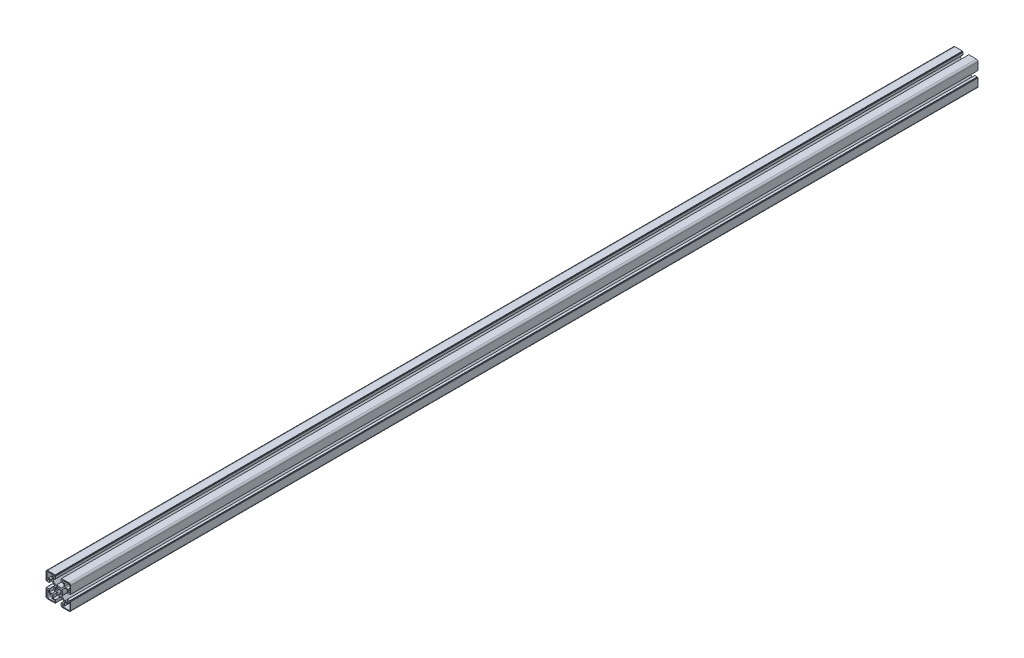
from build123d import *

# Parameters (mm, degrees)
BOSS_EXTRUDE1_DEPTH = 829.25


with BuildPart() as part:
    # Sketch1 → Boss-Extrude1 (new, symmetric)
    with BuildSketch(Plane.XY):
        with BuildLine():
            Line((-19.5072, 22.5044), (-5.7912, 22.5044))
            Line((-5.7912, 22.5044), (-5.7912, 21.0058))
            Line((-5.7912, 21.0058), (-5.0038, 21.0058))
            Line((-5.0038, 21.0058), (-5.0038, 16.51))
            Line((-5.0038, 16.51), (-10.0457, 16.51))
            Line((-10.0457, 16.51), (-10.0457, 11.680106614))
            Line((-10.0457, 11.680106614), (-4.781026704, 6.415433318))
            ThreePointArc((-4.781026704, 6.415433318), (0, 8.001), (4.781026704, 6.415433318))
            Line((4.781026704, 6.415433318), (10.0457, 11.680106614))
            Line((10.0457, 11.680106614), (10.0457, 16.51))
            Line((10.0457, 16.51), (5.0038, 16.51))
            Line((5.0038, 16.51), (5.0038, 21.0058))
            Line((5.0038, 21.0058), (5.7912, 21.0058))
            Line((5.7912, 21.0058), (5.7912, 22.5044))
            Line((5.7912, 22.5044), (19.5072, 22.5044))
            ThreePointArc((19.5072, 22.5044), (21.626540445, 21.626540445), (22.5044, 19.5072))
            Line((22.5044, 19.5072), (22.5044, 5.7912))
            Line((22.5044, 5.7912), (21.0058, 5.7912))
            Line((21.0058, 5.7912), (21.0058, 5.0038))
            Line((21.0058, 5.0038), (16.51, 5.0038))
            Line((16.51, 5.0038), (16.51, 10.0457))
            Line((16.51, 10.0457), (11.680106614, 10.0457))
            Line((11.680106614, 10.0457), (6.415433318, 4.781026704))
            ThreePointArc((6.415433318, 4.781026704), (8.001, 0), (6.415433318, -4.781026704))
            Line((6.415433318, -4.781026704), (11.680106614, -10.0457))
            Line((11.680106614, -10.0457), (16.51, -10.0457))
            Line((16.51, -10.0457), (16.51, -5.0038))
            Line((16.51, -5.0038), (21.0058, -5.0038))
            Line((21.0058, -5.0038), (21.0058, -5.7912))
            Line((21.0058, -5.7912), (22.5044, -5.7912))
            Line((22.5044, -5.7912), (22.5044, -19.5072))
            ThreePointArc((22.5044, -19.5072), (21.626540445, -21.626540445), (19.5072, -22.5044))
            Line((19.5072, -22.5044), (5.7912, -22.5044))
            Line((5.7912, -22.5044), (5.7912, -21.0058))
            Line((5.7912, -21.0058), (5.0038, -21.0058))
            Line((5.0038, -21.0058), (5.0038, -16.51))
            Line((5.0038, -16.51), (10.0457, -16.51))
            Line((10.0457, -16.51), (10.0457, -11.680106614))
            Line((10.0457, -11.680106614), (4.781026704, -6.415433318))
            ThreePointArc((4.781026704, -6.415433318), (0, -8.001), (-4.781026704, -6.415433318))
            Line((-4.781026704, -6.415433318), (-10.0457, -11.680106614))
            Line((-10.0457, -11.680106614), (-10.0457, -16.51))
            Line((-10.0457, -16.51), (-5.0038, -16.51))
            Line((-5.0038, -16.51), (-5.0038, -21.0058))
            Line((-5.0038, -21.0058), (-5.7912, -21.0058))
            Line((-5.7912, -21.0058), (-5.7912, -22.5044))
            Line((-5.7912, -22.5044), (-19.5072, -22.5044))
            ThreePointArc((-19.5072, -22.5044), (-21.626540445, -21.626540445), (-22.5044, -19.5072))
            Line((-22.5044, -19.5072), (-22.5044, -5.7912))
            Line((-22.5044, -5.7912), (-21.0058, -5.7912))
            Line((-21.0058, -5.7912), (-21.0058, -5.0038))
            Line((-21.0058, -5.0038), (-16.51, -5.0038))
            Line((-16.51, -5.0038), (-16.51, -10.0457))
            Line((-16.51, -10.0457), (-11.680106614, -10.0457))
            Line((-11.680106614, -10.0457), (-6.415433318, -4.781026704))
            ThreePointArc((-6.415433318, -4.781026704), (-8.001, 0), (-6.415433318, 4.781026704))
            Line((-6.415433318, 4.781026704), (-11.680106614, 10.0457))
            Line((-11.680106614, 10.0457), (-16.51, 10.0457))
            Line((-16.51, 10.0457), (-16.51, 5.0038))
            Line((-16.51, 5.0038), (-21.0058, 5.0038))
            Line((-21.0058, 5.0038), (-21.0058, 5.7912))
            Line((-21.0058, 5.7912), (-22.5044, 5.7912))
            Line((-22.5044, 5.7912), (-22.5044, 19.5072))
            ThreePointArc((-22.5044, 19.5072), (-21.626540445, 21.626540445), (-19.5072, 22.5044))
        make_face()
        with BuildLine():
            Line((-18.0086, 11.5443), (-13.0429, 11.5443))
            ThreePointArc((-13.0429, 11.5443), (-11.983229778, 11.983229778), (-11.5443, 13.0429))
            Line((-11.5443, 13.0429), (-11.5443, 18.0086))
            Line((-11.5443, 18.0086), (-8.7884, 18.0086))
            ThreePointArc((-8.7884, 18.0086), (-7.2898, 19.5072), (-8.7884, 21.0058))
            Line((-8.7884, 21.0058), (-19.5072, 21.0058))
            ThreePointArc((-19.5072, 21.0058), (-20.566870222, 20.566870222), (-21.0058, 19.5072))
            Line((-21.0058, 19.5072), (-21.0058, 8.7884))
            ThreePointArc((-21.0058, 8.7884), (-19.5072, 7.2898), (-18.0086, 8.7884))
            Line((-18.0086, 8.7884), (-18.0086, 11.5443))
        make_face(mode=Mode.SUBTRACT)
        with BuildLine():
            Line((1.189270603, 5.978867069), (0.976192953, 4.907653386))
            ThreePointArc((0.976192953, 4.907653386), (0, 5.0038), (-0.976192953, 4.907653386))
            Line((-0.976192953, 4.907653386), (-1.189270603, 5.978867069))
            ThreePointArc((-1.189270603, 5.978867069), (-2.332838204, 5.63196963), (-3.38675614, 5.068638757))
            Line((-3.38675614, 5.068638757), (-2.779962332, 4.160507646))
            ThreePointArc((-2.779962332, 4.160507646), (-3.538220912, 3.538220912), (-4.160507646, 2.779962332))
            Line((-4.160507646, 2.779962332), (-5.068638757, 3.38675614))
            ThreePointArc((-5.068638757, 3.38675614), (-5.63196963, 2.332838204), (-5.978867069, 1.189270603))
            Line((-5.978867069, 1.189270603), (-4.907653386, 0.976192953))
            ThreePointArc((-4.907653386, 0.976192953), (-5.0038, 0), (-4.907653386, -0.976192953))
            Line((-4.907653386, -0.976192953), (-5.978867069, -1.189270603))
            ThreePointArc((-5.978867069, -1.189270603), (-5.63196963, -2.332838204), (-5.068638757, -3.38675614))
            Line((-5.068638757, -3.38675614), (-4.160507646, -2.779962332))
            ThreePointArc((-4.160507646, -2.779962332), (-3.538220912, -3.538220912), (-2.779962332, -4.160507646))
            Line((-2.779962332, -4.160507646), (-3.38675614, -5.068638757))
            ThreePointArc((-3.38675614, -5.068638757), (-2.332838204, -5.63196963), (-1.189270603, -5.978867069))
            Line((-1.189270603, -5.978867069), (-0.976192953, -4.907653386))
            ThreePointArc((-0.976192953, -4.907653386), (0, -5.0038), (0.976192953, -4.907653386))
            Line((0.976192953, -4.907653386), (1.189270603, -5.978867069))
            ThreePointArc((1.189270603, -5.978867069), (2.332838204, -5.63196963), (3.38675614, -5.068638757))
            Line((3.38675614, -5.068638757), (2.779962332, -4.160507646))
            ThreePointArc((2.779962332, -4.160507646), (3.538220912, -3.538220912), (4.160507646, -2.779962332))
            Line((4.160507646, -2.779962332), (5.068638757, -3.38675614))
            ThreePointArc((5.068638757, -3.38675614), (5.63196963, -2.332838204), (5.978867069, -1.189270603))
            Line((5.978867069, -1.189270603), (4.907653386, -0.976192953))
            ThreePointArc((4.907653386, -0.976192953), (5.0038, 0), (4.907653386, 0.976192953))
            Line((4.907653386, 0.976192953), (5.978867069, 1.189270603))
            ThreePointArc((5.978867069, 1.189270603), (5.63196963, 2.332838204), (5.068638757, 3.38675614))
            Line((5.068638757, 3.38675614), (4.160507646, 2.779962332))
            ThreePointArc((4.160507646, 2.779962332), (3.538220912, 3.538220912), (2.779962332, 4.160507646))
            Line((2.779962332, 4.160507646), (3.38675614, 5.068638757))
            ThreePointArc((3.38675614, 5.068638757), (2.332838204, 5.63196963), (1.189270603, 5.978867069))
        make_face(mode=Mode.SUBTRACT)
        with BuildLine():
            Line((11.5443, 18.0086), (8.7884, 18.0086))
            ThreePointArc((8.7884, 18.0086), (7.2898, 19.5072), (8.7884, 21.0058))
            Line((8.7884, 21.0058), (19.5072, 21.0058))
            ThreePointArc((19.5072, 21.0058), (20.566870222, 20.566870222), (21.0058, 19.5072))
            Line((21.0058, 19.5072), (21.0058, 8.7884))
            ThreePointArc((21.0058, 8.7884), (19.5072, 7.2898), (18.0086, 8.7884))
            Line((18.0086, 8.7884), (18.0086, 11.5443))
            Line((18.0086, 11.5443), (13.0429, 11.5443))
            ThreePointArc((13.0429, 11.5443), (11.983229778, 11.983229778), (11.5443, 13.0429))
            Line((11.5443, 13.0429), (11.5443, 18.0086))
        make_face(mode=Mode.SUBTRACT)
        with BuildLine():
            Line((18.0086, -11.5443), (13.0429, -11.5443))
            ThreePointArc((13.0429, -11.5443), (11.983229778, -11.983229778), (11.5443, -13.0429))
            Line((11.5443, -13.0429), (11.5443, -18.0086))
            Line((11.5443, -18.0086), (8.7884, -18.0086))
            ThreePointArc((8.7884, -18.0086), (7.2898, -19.5072), (8.7884, -21.0058))
            Line((8.7884, -21.0058), (19.5072, -21.0058))
            ThreePointArc((19.5072, -21.0058), (20.566870222, -20.566870222), (21.0058, -19.5072))
            Line((21.0058, -19.5072), (21.0058, -8.7884))
            ThreePointArc((21.0058, -8.7884), (19.5072, -7.2898), (18.0086, -8.7884))
            Line((18.0086, -8.7884), (18.0086, -11.5443))
        make_face(mode=Mode.SUBTRACT)
        with BuildLine():
            Line((-11.5443, -18.0086), (-8.7884, -18.0086))
            ThreePointArc((-8.7884, -18.0086), (-7.2898, -19.5072), (-8.7884, -21.0058))
            Line((-8.7884, -21.0058), (-19.5072, -21.0058))
            ThreePointArc((-19.5072, -21.0058), (-20.566870222, -20.566870222), (-21.0058, -19.5072))
            Line((-21.0058, -19.5072), (-21.0058, -8.7884))
            ThreePointArc((-21.0058, -8.7884), (-19.5072, -7.2898), (-18.0086, -8.7884))
            Line((-18.0086, -8.7884), (-18.0086, -11.5443))
            Line((-18.0086, -11.5443), (-13.0429, -11.5443))
            ThreePointArc((-13.0429, -11.5443), (-11.983229778, -11.983229778), (-11.5443, -13.0429))
            Line((-11.5443, -13.0429), (-11.5443, -18.0086))
        make_face(mode=Mode.SUBTRACT)
    extrude(amount=BOSS_EXTRUDE1_DEPTH, both=True)


solid = part.part
